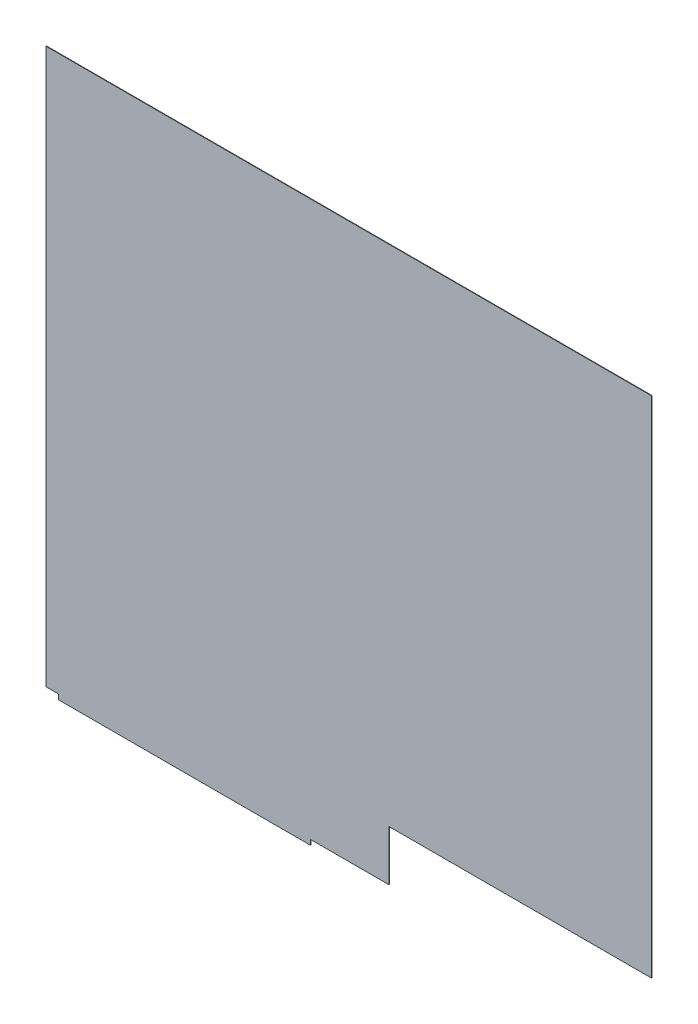
from build123d import *

# Parameters (mm, degrees)
BOSS_EXTRUDE1_DEPTH = 5


with BuildPart() as part:
    # Sketch1 → Boss-Extrude1 (new body)
    with BuildSketch(Plane.XY):
        Polygon((-2830, -2800), (-2950, -2800), (-2950, 2700), (3050, 2700), (3050, -2300), (450, -2300), (450, -2800), (-330, -2800), (-330, -2850), (-2830, -2850), align=None)
    extrude(amount=BOSS_EXTRUDE1_DEPTH)


solid = part.part
